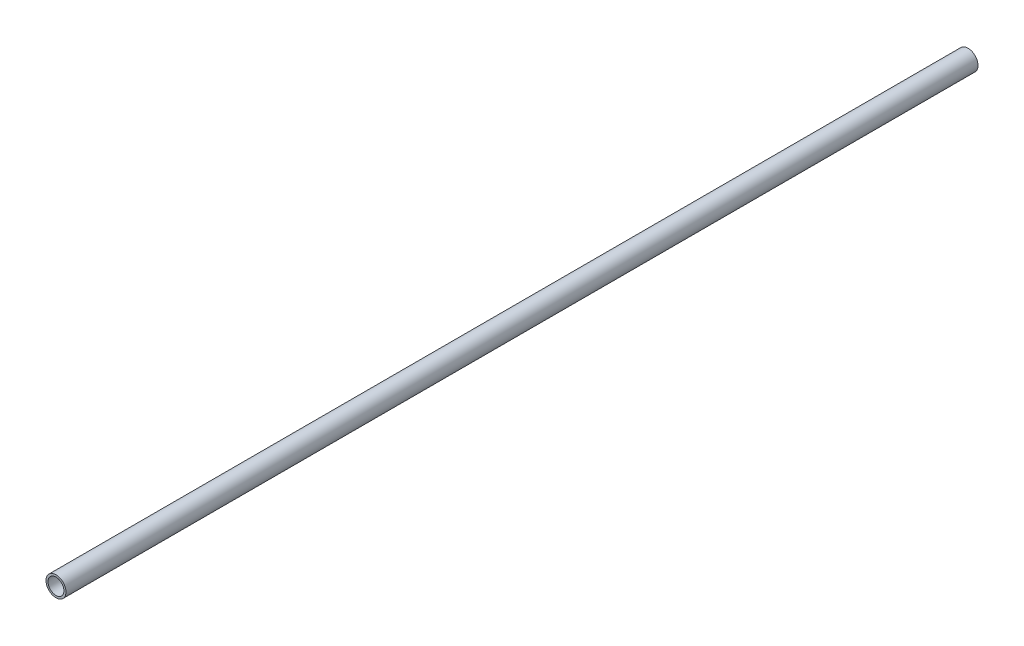
from build123d import *

# Parameters (mm, degrees)
SKETCH1_R           = 16.7005
SKETCH1_R_2         = 13.3223
BOSS_EXTRUDE1_DEPTH = 1524


with BuildPart() as part:
    # Sketch1 → Boss-Extrude1 (new body)
    with BuildSketch(Plane.XY):
        Circle(SKETCH1_R)
        Circle(SKETCH1_R_2, mode=Mode.SUBTRACT)
    extrude(amount=-BOSS_EXTRUDE1_DEPTH)


solid = part.part
